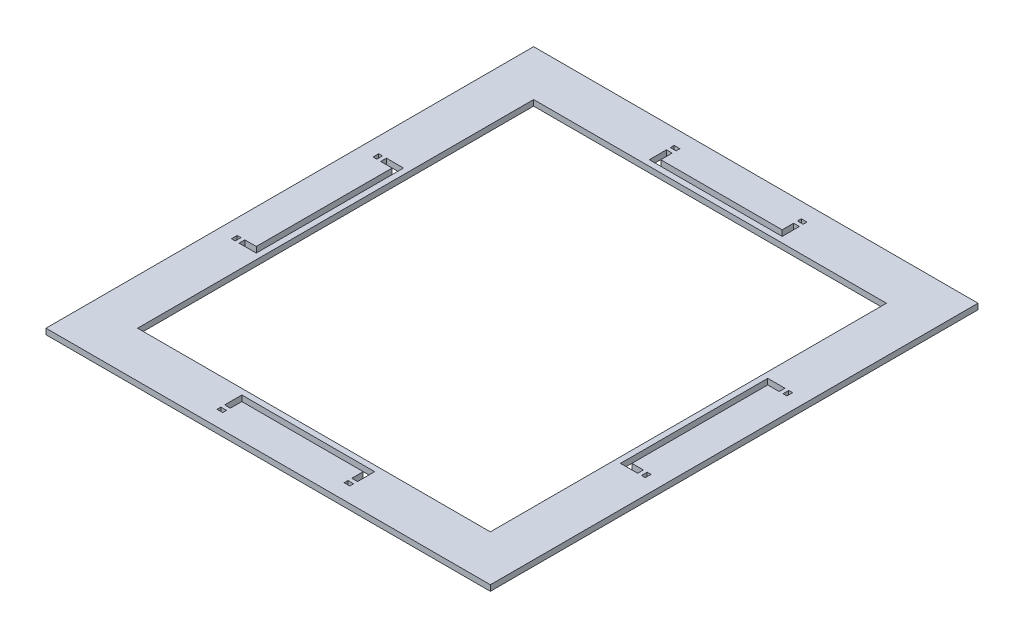
from build123d import *

# Parameters (mm, degrees)
SKETCH1_W                 = 2.116666666
SKETCH1_H                 = 3.175
SKETCH1_W_2               = 3.175
SKETCH1_H_2               = 2.116666666
SKETCH1_W_3               = 6.35
SKETCH1_H_3               = 37.666666667
SKETCH1_W_4               = 33.666666667
SKETCH1_H_4               = 6.35
BOSS_EXTRUDE1_DEPTH       = 3.175
SKETCH3_W                 = 3.175
SKETCH3_H                 = 3.175
SKETCH3_W_2               = 97.825
SKETCH3_H_2               = 109.825
BOSS_EXTRUDE2_DEPTH       = 3.175
MIRROR5_COPY_1_SKETCH_W   = 2.116666666
MIRROR5_COPY_1_SKETCH_H   = 3.175
MIRROR5_COPY_1_SKETCH_W_2 = 3.175
MIRROR5_COPY_1_SKETCH_H_2 = 2.116666666
MIRROR5_COPY_1_SKETCH_W_3 = 6.35
MIRROR5_COPY_1_SKETCH_H_3 = 37.666666667
MIRROR5_COPY_1_SKETCH_W_4 = 33.666666667
MIRROR5_COPY_1_SKETCH_H_4 = 6.35
MIRROR5_COPY_1_DEPTH      = 3.175
MIRROR5_COPY_2_SKETCH_W   = 3.175
MIRROR5_COPY_2_SKETCH_H   = 3.175
MIRROR5_COPY_2_SKETCH_W_2 = 97.825
MIRROR5_COPY_2_SKETCH_H_2 = 109.825
MIRROR5_COPY_2_DEPTH      = 3.175


with BuildPart() as part:
    # Sketch1 → Boss-Extrude1 (new body)
    # profile 1 of 4: a face of its own
    with BuildSketch(Plane(origin=(0, 0, 0), x_dir=(1, 0, 0), z_dir=(0, 1, 0))):
        Polygon((0, 122.525), (0, 135.225), (-123.225, 135.225), (-123.225, 0), (-110.525, 0), (-110.525, 37.666666667), (-110.525, 40.841666667), (-110.525, 122.525), (-78.927699489, 122.525), (-36.841666667, 122.525), (-33.666666667, 122.525), align=None)
        with Locations((-113.7, 39.254166667)):
            Rectangle(SKETCH1_W, SKETCH1_H, mode=Mode.SUBTRACT)
        with Locations((-35.254166667, 125.7)):
            Rectangle(SKETCH1_W_2, SKETCH1_H_2, mode=Mode.SUBTRACT)
    # profile 2 of 4: a face of its own
    with BuildSketch(Plane(origin=(0, 0, 0), x_dir=(1, 0, 0), z_dir=(0, 1, 0))):
        with Locations((-107.35, 18.833333334)):
            Rectangle(SKETCH1_W_3, SKETCH1_H_3)
    # profile 3 of 4: a face of its own
    with BuildSketch(Plane(origin=(0, 0, 0), x_dir=(1, 0, 0), z_dir=(0, 1, 0))):
        Polygon((-36.841666667, 113), (-36.841666667, 122.525), (-78.927699489, 122.525), (-110.525, 122.525), (-110.525, 40.841666667), (-101, 40.841666667), (-101, 113), align=None)
    # profile 4 of 4: a face of its own
    with BuildSketch(Plane(origin=(0, 0, 0), x_dir=(1, 0, 0), z_dir=(0, 1, 0))):
        with Locations((-16.833333334, 119.35)):
            Rectangle(SKETCH1_W_4, SKETCH1_H_4)
    boss_extrude1 = extrude(amount=BOSS_EXTRUDE1_DEPTH)

    # Sketch3 → Boss-Extrude2 (add)
    with BuildSketch(Plane(origin=(0, 3.175, 0), x_dir=(1, 0, 0), z_dir=(0, 1, 0))):
        with Locations((-99.4125, 111.4125)):
            Rectangle(SKETCH3_W, SKETCH3_H)
        with Locations((-48.9125, 111.4125)):
            Rectangle(SKETCH3_W_2, SKETCH3_H)
        with Locations((-99.4125, 54.9125)):
            Rectangle(SKETCH3_W, SKETCH3_H_2)
    boss_extrude2 = extrude(amount=-BOSS_EXTRUDE2_DEPTH)

    # Mirror4: Boss-Extrude1, Boss-Extrude2 across plane
    add(boss_extrude1.mirror(Plane(origin=(0, 0, 0), x_dir=(0, 0, 1), z_dir=(1, 0, 0))))
    add(boss_extrude2.mirror(Plane(origin=(0, 0, 0), x_dir=(0, 0, 1), z_dir=(1, 0, 0))))

    # Mirror5: Boss-Extrude1, Boss-Extrude2 across plane
    add(boss_extrude1.mirror(Plane.XY))
    add(boss_extrude2.mirror(Plane.XY))

    # Mirror5 copy 1 sketch → Mirror5 copy 1 (add)
    # profile 1 of 4: a face of its own
    with BuildSketch(Plane(origin=(0, 0, 0), x_dir=(-1, 0, 0), z_dir=(0, 1, 0))):
        Polygon((0, 122.525), (0, 135.225), (-123.225, 135.225), (-123.225, 0), (-110.525, 0), (-110.525, 37.666666667), (-110.525, 40.841666667), (-110.525, 122.525), (-78.927699489, 122.525), (-36.841666667, 122.525), (-33.666666667, 122.525), align=None)
        with Locations((-113.7, 39.254166667)):
            Rectangle(MIRROR5_COPY_1_SKETCH_W, MIRROR5_COPY_1_SKETCH_H, mode=Mode.SUBTRACT)
        with Locations((-35.254166667, 125.7)):
            Rectangle(MIRROR5_COPY_1_SKETCH_W_2, MIRROR5_COPY_1_SKETCH_H_2, mode=Mode.SUBTRACT)
    # profile 2 of 4: a face of its own
    with BuildSketch(Plane(origin=(0, 0, 0), x_dir=(-1, 0, 0), z_dir=(0, 1, 0))):
        with Locations((-107.35, 18.833333334)):
            Rectangle(MIRROR5_COPY_1_SKETCH_W_3, MIRROR5_COPY_1_SKETCH_H_3)
    # profile 3 of 4: a face of its own
    with BuildSketch(Plane(origin=(0, 0, 0), x_dir=(-1, 0, 0), z_dir=(0, 1, 0))):
        Polygon((-36.841666667, 113), (-36.841666667, 122.525), (-78.927699489, 122.525), (-110.525, 122.525), (-110.525, 40.841666667), (-101, 40.841666667), (-101, 113), align=None)
    # profile 4 of 4: a face of its own
    with BuildSketch(Plane(origin=(0, 0, 0), x_dir=(-1, 0, 0), z_dir=(0, 1, 0))):
        with Locations((-16.833333334, 119.35)):
            Rectangle(MIRROR5_COPY_1_SKETCH_W_4, MIRROR5_COPY_1_SKETCH_H_4)
    extrude(amount=MIRROR5_COPY_1_DEPTH)

    # Mirror5 copy 2 sketch → Mirror5 copy 2 (add)
    with BuildSketch(Plane(origin=(0, 3.175, 0), x_dir=(-1, 0, 0), z_dir=(0, 1, 0))):
        with Locations((-99.4125, 111.4125)):
            Rectangle(MIRROR5_COPY_2_SKETCH_W, MIRROR5_COPY_2_SKETCH_H)
        with Locations((-48.9125, 111.4125)):
            Rectangle(MIRROR5_COPY_2_SKETCH_W_2, MIRROR5_COPY_2_SKETCH_H)
        with Locations((-99.4125, 54.9125)):
            Rectangle(MIRROR5_COPY_2_SKETCH_W, MIRROR5_COPY_2_SKETCH_H_2)
    extrude(amount=-MIRROR5_COPY_2_DEPTH)


solid = part.part
